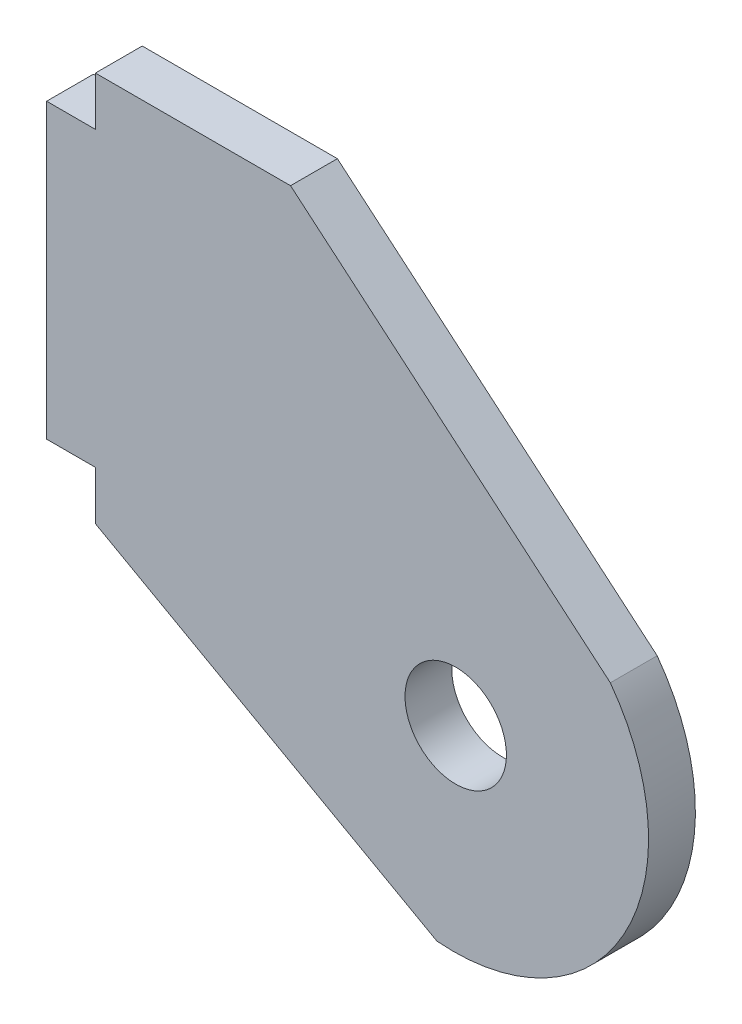
from build123d import *

# Parameters (mm, degrees)
SKETCH1_R           = 3.3
BOSS_EXTRUDE1_DEPTH = 3.048


with BuildPart() as part:
    # Sketch1 → Boss-Extrude1 (new body)
    with BuildSketch(Plane.XY):
        with BuildLine():
            Line((427.919423357, 0), (440.619423357, 0))
            Line((440.619423357, 0), (461.432219063, -17.609164677))
            ThreePointArc((461.432219063, -17.609164677), (462.308947418, -31.354922495), (450.144423357, -37.815484776))
            Line((450.144423357, -37.815484776), (427.919423357, -25.4))
            Line((427.919423357, -25.4), (427.919423357, -22.225))
            Line((427.919423357, -22.225), (424.744423357, -22.225))
            Line((424.744423357, -22.225), (424.744423357, -3.175))
            Line((424.744423357, -3.175), (427.919423357, -3.175))
            Line((427.919423357, -3.175), (427.919423357, 0))
        make_face()
        with Locations(Location((451.368205009, -25.058241389, 0), (0, 0, 180))):
            Circle(SKETCH1_R, mode=Mode.SUBTRACT)
    extrude(amount=BOSS_EXTRUDE1_DEPTH)


solid = part.part
